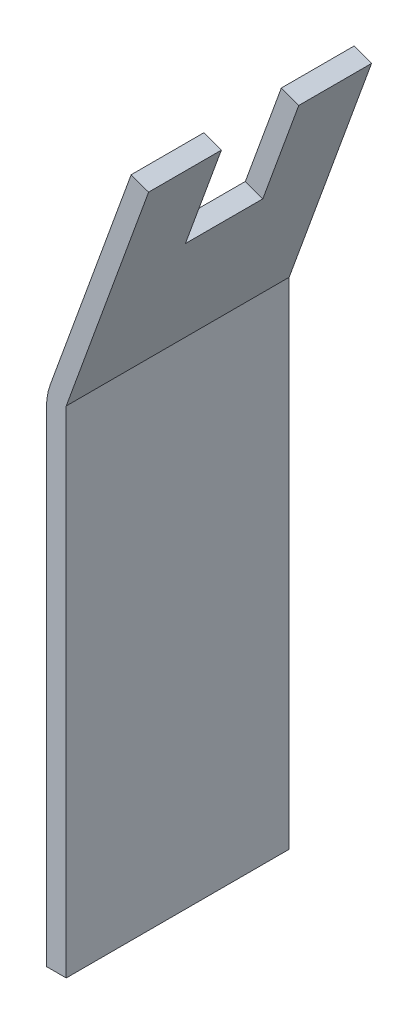
from build123d import *

# Parameters (mm, degrees)
BOSS_EXTRU_1_DEPTH      = 18
BOSS_EXTRU_1_DEPTH_BACK = 18
CONG_1_R                = 10
ESQUISSE2_W             = 12.5
ESQUISSE2_H             = 17
ENL_V_MAT_EXTRU_1_DEPTH = 3


with BuildPart() as part:
    # Esquisse1 → Boss.-Extru.1 (new, two sides: drawn at the far end of the back side and taken through both)
    with BuildSketch(Plane.XY.offset(-BOSS_EXTRU_1_DEPTH_BACK)):
        Polygon((0, 0), (0, 80), (13.680805733, 117.587704831), (16.499883595, 116.561644401), (3.192533317, 80), (3.192533317, 0), align=None)
    extrude(amount=BOSS_EXTRU_1_DEPTH + BOSS_EXTRU_1_DEPTH_BACK)

    # Congé1
    cong_1_edges = [part.edges().sort_by_distance(p)[0] for p in [
        (0, 80, 0),
    ]]
    fillet(cong_1_edges, radius=CONG_1_R)

    # Esquisse2 → Enlèv. mat.-Extru.1 (cut)
    with BuildSketch(Plane(origin=(-25.711504387, 9.358222275, 0), x_dir=(0, 0, 1), z_dir=(-0.9396926207859093, 0.34202014332566644, 0))):
        with Locations((0, 106.675409663)):
            Rectangle(ESQUISSE2_W, ESQUISSE2_H)
    extrude(amount=-ENL_V_MAT_EXTRU_1_DEPTH, mode=Mode.SUBTRACT)


solid = part.part
